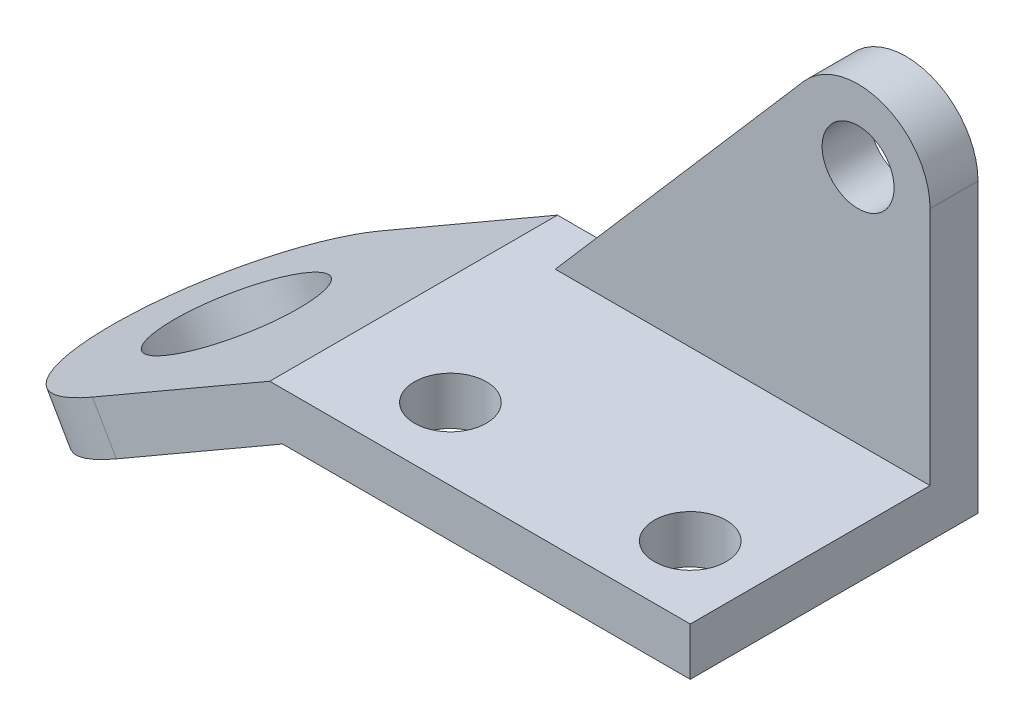
from build123d import *

# Parameters (mm, degrees)
BOSS_EXTRUDE1_DEPTH = 60
SKETCH1_3_R         = 7.5
BOSS_EXTRUDE2_DEPTH = 10
SKETCH2_R           = 7.5
CUT_EXTRUDE1_DEPTH  = 123.678441464
FILLET1_RADIUS      = 30
FILLET1_LENGTH      = 10
SKETCH3_R           = 15
CUT_EXTRUDE2_DEPTH  = 127.889565743


with BuildPart() as part:
    # Sketch1 → Boss-Extrude1 (new body)
    with BuildSketch(Plane.XY):
        Polygon((0, 0), (85, 0), (85, 10), (-2.679491924, 10), (-65.621778265, -26.339745962), (-60.621778265, -35), align=None)
    extrude(amount=BOSS_EXTRUDE1_DEPTH)

    # Sketch1<3> → Boss-Extrude2 (add)
    with BuildSketch(Plane.XY):
        with BuildLine():
            Line((6.864064603, 10), (85, 10))
            Line((85, 10), (85, 60))
            ThreePointArc((85, 60), (75.23946894, 74.055175745), (58.660271303, 69.818887568))
            Line((58.660271303, 69.818887568), (6.864064603, 10))
        make_face()
        with Locations((70, 60)):
            Circle(SKETCH1_3_R, mode=Mode.SUBTRACT)
    extrude(amount=BOSS_EXTRUDE2_DEPTH)

    # Sketch2 → Cut-Extrude1 (cut, through all)
    with BuildSketch(Plane(origin=(0, 10, 0), x_dir=(1, 0, 0), z_dir=(0, 1, 0))):
        with Locations(Location((20, -45, 0), (0, 0, 270))):
            Circle(SKETCH2_R)
        with Locations(Location((70, -45, 0), (0, 0, 270))):
            Circle(SKETCH2_R)
    extrude(amount=-CUT_EXTRUDE1_DEPTH, mode=Mode.SUBTRACT)

    # Fillet1: full round fillet: the end face becomes a half cylinder, R = half its width
    fillet1_face = Plane((-63.121778265, -30.669872981, 30), x_dir=(-0.5, 0.866025403784, 0), z_dir=(-0.866025403784, -0.5, 0))  # on the end face: x along it, z out of the body
    fillet1_slab = fillet1_face.offset(-FILLET1_RADIUS / 2) * Box(FILLET1_LENGTH, 2 * FILLET1_RADIUS, FILLET1_RADIUS, mode=Mode.PRIVATE)  # the body's end, R deep
    fillet1_round = Plane((-37.141016151, -15.669872981, 30), x_dir=(-0.866025403784, -0.5, 0), z_dir=(-0.5, 0.866025403784, 0)) * Cylinder(FILLET1_RADIUS, FILLET1_LENGTH, mode=Mode.PRIVATE)  # its axis R under the face
    add(fillet1_slab - fillet1_round, mode=Mode.SUBTRACT)

    # Sketch3 → Cut-Extrude2 (cut, through all)
    with BuildSketch(Plane(origin=(-5, 8.660254038, 0), x_dir=(0.8660254037844345, 0.5000000000000073, 0), z_dir=(-0.5000000000000073, 0.8660254037844345, 0))):
        with Locations(Location((-40, -30, 0), (0, 0, 180))):
            Circle(SKETCH3_R)
    extrude(amount=-CUT_EXTRUDE2_DEPTH, mode=Mode.SUBTRACT)


solid = part.part
